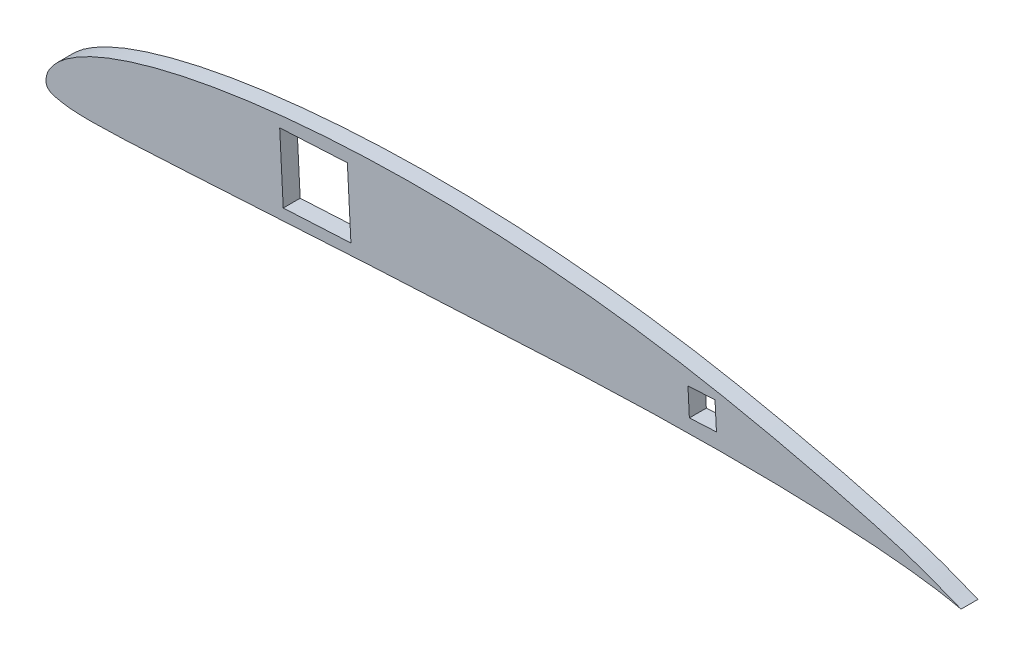
from build123d import *

# Parameters (mm, degrees)
BOSS_EXTRUDE1_DEPTH = 5


with BuildPart() as part:
    # Sketch1 → Boss-Extrude1 (new body)
    with BuildSketch(Plane.XY):
        with BuildLine():
            add(Edge.make_bspline(
                [(270, 0), (270.001436067, 0.009107405), (268.932933558, 0.352495646), (267.906768705, 0.800062229), (265.493337403, 1.754738112), (262.648403106, 2.919508457), (259.022541081, 4.299422433), (254.761430832, 5.754227714), (249.810113571, 7.265271836), (244.210175447, 8.86000319), (237.993728291, 10.535115835), (231.212223769, 12.266490942), (223.918686457, 14.035986434), (216.168249336, 15.817671132), (208.019279368, 17.586839989), (199.531594051, 19.308849319), (190.757583875, 20.952668782), (181.729078705, 22.446563535), (172.485706502, 23.778880627), (163.067203005, 24.949636107), (153.514388277, 25.926027355), (143.873797479, 26.720630751), (134.190671536, 27.317931762), (124.515804536, 27.706451524), (114.898008488, 27.902696712), (105.384918155, 27.886864858), (96.025885422, 27.668047953), (86.868403851, 27.253752623), (77.961345233, 26.644929928), (69.35129815, 25.854601821), (61.083945503, 24.88718815), (53.204283366, 23.7510727), (45.75223324, 22.464443982), (38.767317027, 21.03094444), (32.285460779, 19.468254867), (26.337844602, 17.793495066), (20.956808743, 16.015791751), (16.161330709, 14.167604478), (11.975730704, 12.243103476), (8.419068717, 10.259041262), (5.472242964, 8.274548329), (3.162430323, 6.261264624), (1.478979381, 4.293083172), (0.371136915, 2.38878086), (-0.028186054, 0.614855639), (-0.014220637, -1.034555315), (1.170171151, -2.329008204), (3.191596638, -2.861610206), (5.900938941, -3.41461399), (9.503770594, -3.670988449), (13.940140176, -3.732291891), (19.237427863, -3.615179778), (25.368431611, -3.360900663), (32.295387746, -3.004453917), (39.965688156, -2.570181112), (48.322523014, -2.071535165), (57.305003865, -1.531721296), (66.846774726, -0.96142336), (76.878076189, -0.378270295), (87.325082432, 0.209915111), (98.110689784, 0.793603648), (109.157898555, 1.367589163), (120.393777003, 1.94386939), (131.757912783, 2.542116383), (143.201063086, 3.137782813), (154.665861127, 3.704101734), (166.072995783, 4.174175733), (177.32201621, 4.516393994), (188.310538638, 4.740747809), (198.94497761, 4.83921239), (209.136302534, 4.808551014), (218.796298238, 4.649921554), (227.838646738, 4.368141791), (236.181287302, 3.97467364), (243.743065142, 3.484691083), (250.459331692, 2.918267219), (256.238976815, 2.310371582), (261.088929812, 1.667980045), (264.748869214, 1.083641172), (267.668480022, 0.489833575), (268.860809828, 0.278822671), (269.998549627, -0.009198137), (270, 0)],
                knots=[0, 0, 0, 0, 0.000978925, 0.003785915, 0.008178786, 0.013939636, 0.020914584, 0.029056598, 0.038413559, 0.048973972, 0.060645419, 0.073333851, 0.086939075, 0.101355023, 0.116470865, 0.132170767, 0.148332165, 0.164889948, 0.181806831, 0.198986829, 0.216369093, 0.233891214, 0.251455205, 0.268989944, 0.286410199, 0.30363306, 0.320588513, 0.33718727, 0.353353473, 0.369012335, 0.384083455, 0.398499749, 0.412191497, 0.425098469, 0.437171363, 0.448351495, 0.458605679, 0.467900991, 0.476215593, 0.483572991, 0.489970137, 0.495456444, 0.500131703, 0.503991848, 0.507230008, 0.509986767, 0.512500662, 0.516073685, 0.521095012, 0.527571392, 0.53558732, 0.545177111, 0.556301643, 0.568874715, 0.582800206, 0.597975202, 0.614286016, 0.631612678, 0.649825892, 0.668791608, 0.688371086, 0.708416853, 0.728796853, 0.749399049, 0.770145767, 0.790953093, 0.811664203, 0.832074041, 0.851999344, 0.871281672, 0.889760566, 0.907279934, 0.923686414, 0.93883251, 0.952579327, 0.964796492, 0.975364982, 0.984179192, 0.991107071, 0.996049394, 0.999011322, 1, 1, 1, 1], degree=3))
        make_face()
        Polygon((68.953280875, 22.472590695), (70, 2.5), (89.972590695, 3.546719125), (88.92587157, 23.51930982), align=None, mode=Mode.SUBTRACT)
        Polygon((189.416856521, 16.769351027), (189.835544171, 8.780314749), (197.824580449, 9.199002399), (197.405892799, 17.188038677), align=None, mode=Mode.SUBTRACT)
    extrude(amount=BOSS_EXTRUDE1_DEPTH)


solid = part.part
